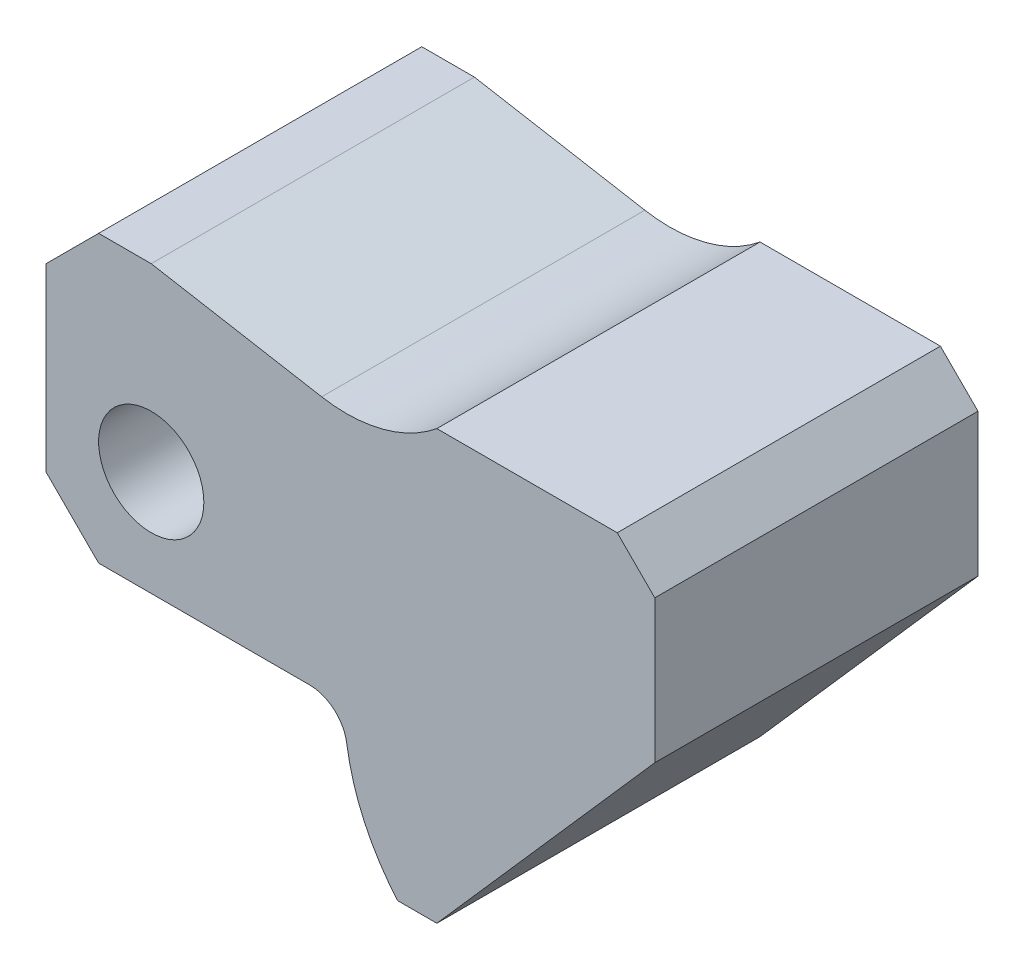
from build123d import *

# Parameters (mm, degrees)
SKETCH1_W               = 81
SKETCH1_H               = 57
BOSS_EXTRUDE1_DEPTH     = 43
CUT_EXTRUDE1_DEPTH      = 87.180044094
CUT_EXTRUDE1_DEPTH_BACK = 87.180044094
CUT_EXTRUDE2_DEPTH      = 87.180044094
CUT_EXTRUDE2_DEPTH_BACK = 87.180044094
SKETCH3_W               = 56.062487614
SKETCH3_H               = 49.157310494
CUT_EXTRUDE4_DEPTH      = 87.180044094
CUT_EXTRUDE4_DEPTH_BACK = 87.180044094
SKETCH4_R               = 7
FILLET1_R               = 5
CUT_EXTRUDE5_DEPTH      = 87.180044094
CUT_EXTRUDE5_DEPTH_BACK = 87.180044094
CUT_EXTRUDE7_DEPTH      = 87.180044094
CUT_EXTRUDE7_DEPTH_BACK = 87.180044094
SKETCH6_R               = 19
CUT_EXTRUDE8_DEPTH      = 87.180044094
CUT_EXTRUDE8_DEPTH_BACK = 87.180044094


with BuildPart() as part:
    # Sketch1 → Boss-Extrude1 (new body)
    with BuildSketch(Plane.XY):
        with Locations((26.5, -4.5)):
            Rectangle(SKETCH1_W, SKETCH1_H)
    extrude(amount=BOSS_EXTRUDE1_DEPTH)

    # Sketch2 → Cut-Extrude1 (cut, two sides: drawn at the far end of the back side and taken through both)
    with BuildSketch(Plane.XY.offset(-CUT_EXTRUDE1_DEPTH_BACK)):
        Polygon((38, -33), (67, 0), (92.563073461, 0), (92.563073461, -46.247191662), (38, -46.247191662), align=None)
    extrude(amount=CUT_EXTRUDE1_DEPTH + CUT_EXTRUDE1_DEPTH_BACK, mode=Mode.SUBTRACT)

    # Sketch3 → Cut-Extrude2 (cut, two sides: drawn at the far end of the back side and taken through both)
    with BuildSketch(Plane.XY.offset(-CUT_EXTRUDE2_DEPTH_BACK)):
        Polygon((67, 19), (62, 24), (62, 35.07400688), (76.394076925, 35.07400688), (76.394076925, 19), align=None)
        with Locations((-2.33427411, -38.578655247)):
            Rectangle(SKETCH3_W, SKETCH3_H)
    extrude(amount=CUT_EXTRUDE2_DEPTH + CUT_EXTRUDE2_DEPTH_BACK, mode=Mode.SUBTRACT)

    # Sketch4 → Cut-Extrude4 (cut, two sides: drawn at the far end of the back side and taken through both)
    with BuildSketch(Plane.XY.offset(-CUT_EXTRUDE4_DEPTH_BACK)):
        Circle(SKETCH4_R)
        Polygon((-14, -7), (-7, -14), (-7, -25.581490966), (-25.698807285, -25.581490966), (-25.698807285, 4.698807285), align=None)
        with BuildLine():
            Line((25.696969697, -14), (1.830031376, -60.145765031))
            Line((1.830031376, -60.145765031), (54.696969697, -43))
            ThreePointArc((54.696969697, -43), (34.190873043, -34.506096654), (25.696969697, -14))
        make_face()
    extrude(amount=CUT_EXTRUDE4_DEPTH + CUT_EXTRUDE4_DEPTH_BACK, mode=Mode.SUBTRACT)

    # Fillet1
    fillet1_edges = [part.edges().sort_by_distance(p)[0] for p in [
        (25.696969697, -14, 21.5),
    ]]
    fillet(fillet1_edges, radius=FILLET1_R)

    # Sketch5 → Cut-Extrude5 (cut, two sides: drawn at the far end of the back side and taken through both)
    with BuildSketch(Plane.XY.offset(-CUT_EXTRUDE5_DEPTH_BACK)):
        Polygon((-14, 17), (-7, 24), (-7, 33.910955106), (-24.773301804, 33.910955106), (-24.773301804, 17), align=None)
    extrude(amount=CUT_EXTRUDE5_DEPTH + CUT_EXTRUDE5_DEPTH_BACK, mode=Mode.SUBTRACT)

    # Sketch6 → Cut-Extrude7 (cut, two sides: drawn at the far end of the back side and taken through both)
    with BuildSketch(Plane.XY.offset(-CUT_EXTRUDE7_DEPTH_BACK)):
        with Locations((25.977509097, 38.71256988)):
            Circle(SKETCH6_R)
    extrude(amount=CUT_EXTRUDE7_DEPTH + CUT_EXTRUDE7_DEPTH_BACK, mode=Mode.SUBTRACT)

    # Sketch7 → Cut-Extrude8 (cut, two sides: drawn at the far end of the back side and taken through both)
    with BuildSketch(Plane.XY.offset(-CUT_EXTRUDE8_DEPTH_BACK)):
        with BuildLine():
            Line((13.955018194, 24), (0, 24))
            Line((0, 24), (22.678193721, 20.001222573))
            ThreePointArc((22.678193721, 20.001222573), (18.059997358, 21.440829729), (13.955018194, 24))
        make_face()
    extrude(amount=CUT_EXTRUDE8_DEPTH + CUT_EXTRUDE8_DEPTH_BACK, mode=Mode.SUBTRACT)


solid = part.part
